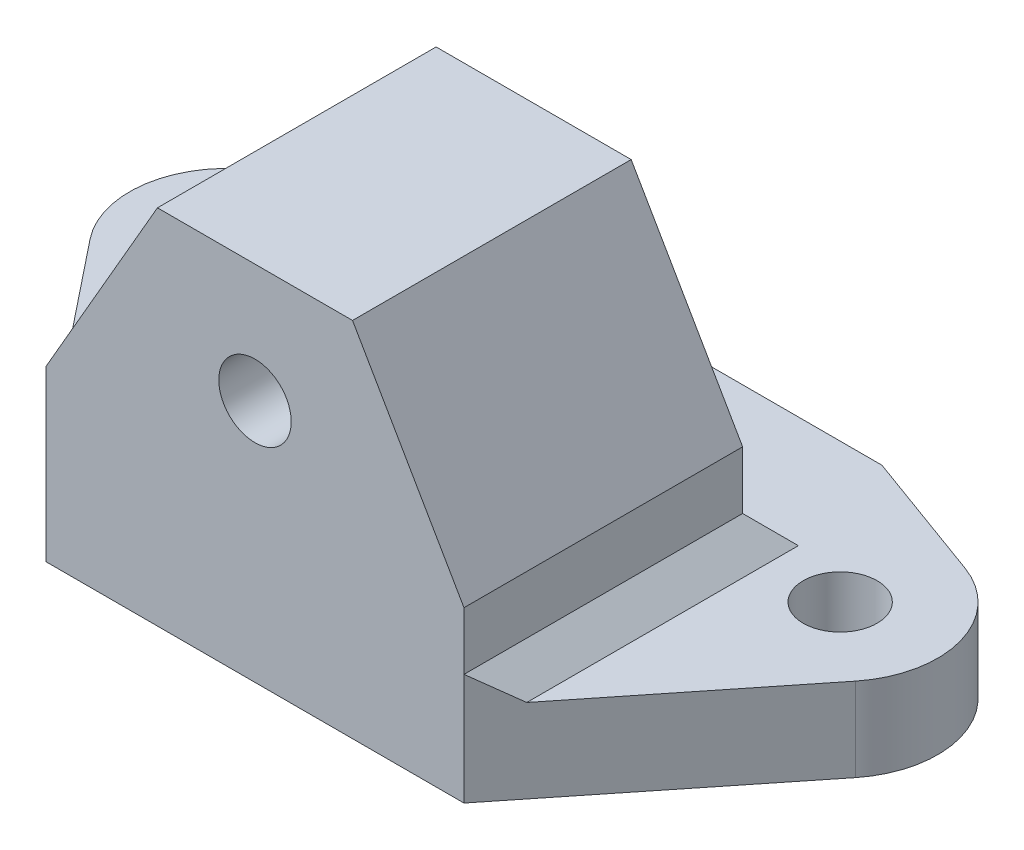
from build123d import *

# Parameters (mm, degrees)
SKETCH1_W           = 30
SKETCH1_H           = 26
BOSS_EXTRUDE1_DEPTH = 30
SKETCH2_R           = 5.25
CUT_EXTRUDE1_DEPTH  = 15
CUT_EXTRUDE2_REACH  = 37.972
SKETCH3_R           = 2.6
SKETCH4_R           = 2.65
BOSS_EXTRUDE2_DEPTH = 6
CHAMFER1_SIZE       = 8
CHAMFER1_SIZE2      = 13.856406461
SKETCH5_W           = 10
SKETCH5_H           = 20
CUT_EXTRUDE3_DEPTH  = 20
CHAMFER2_SIZE       = 2


with BuildPart() as part:
    # Sketch1 → Boss-Extrude1 (new body)
    with BuildSketch(Plane.XY):
        Rectangle(SKETCH1_W, SKETCH1_H)
    extrude(amount=BOSS_EXTRUDE1_DEPTH)

    # Sketch2 → Cut-Extrude1 (cut)
    with BuildSketch(Plane.XY):
        with Locations((0, 4.5)):
            Circle(SKETCH2_R)
    extrude(amount=CUT_EXTRUDE1_DEPTH, mode=Mode.SUBTRACT)

    # Sketch3 → Cut-Extrude2 (cut, up to next)
    with BuildSketch(Plane.XY, mode=Mode.PRIVATE) as cut_extrude2_sk1:
        with Locations((0, 4.5)):
            Circle(SKETCH3_R)
    cut_extrude2_tool1 = extrude(cut_extrude2_sk1.sketch, amount=CUT_EXTRUDE2_REACH, mode=Mode.PRIVATE) & part.part
    add(cut_extrude2_tool1.solids().sort_by_distance((0, 4.5, 0))[0], mode=Mode.SUBTRACT)

    # Sketch4 → Boss-Extrude2 (add)
    # profile 1 of 2: a face of its own
    with BuildSketch(Plane.XZ.offset(13)):
        with BuildLine():
            Line((-15, 30), (-27.472160356, 14.365256125))
            ThreePointArc((-27.472160356, 14.365256125), (-28.738776961, 8.10556471), (-24.395973154, 3.422818792))
            Line((-24.395973154, 3.422818792), (-15, 0))
            Line((-15, 0), (-15, 30))
        make_face()
        with Locations(Location((-22, 10, 0), (0, 0, 270))):
            Circle(SKETCH4_R, mode=Mode.SUBTRACT)
    # profile 2 of 2: a face of its own
    with BuildSketch(Plane.XZ.offset(13)):
        with BuildLine():
            Line((15, 0), (24.395973154, 3.422818792))
            ThreePointArc((24.395973154, 3.422818792), (28.738776961, 8.10556471), (27.472160356, 14.365256125))
            Line((27.472160356, 14.365256125), (15, 30))
            Line((15, 30), (15, 0))
        make_face()
        with Locations(Location((22, 10, 0), (0, 0, 90))):
            Circle(SKETCH4_R, mode=Mode.SUBTRACT)
    extrude(amount=-BOSS_EXTRUDE2_DEPTH)

    # Chamfer1
    chamfer1_edges = [part.edges().sort_by_distance(p)[0] for p in [
        (-15, 13, 15),
        (15, 13, 15),
    ]]
    chamfer1_side = [part.faces().sort_by_distance(p)[0] for p in [
        (0, 13, 15),
    ]]
    chamfer(chamfer1_edges, length=CHAMFER1_SIZE, length2=CHAMFER1_SIZE2, reference=chamfer1_side[0])

    # Sketch5 → Cut-Extrude3 (cut, symmetric)
    with BuildSketch(Plane(origin=(0, 0, 0), x_dir=(0, 0, -1), z_dir=(1, 0, 0))):
        with Locations((-5, 3)):
            Rectangle(SKETCH5_W, SKETCH5_H)
    extrude(amount=CUT_EXTRUDE3_DEPTH, both=True, mode=Mode.SUBTRACT)

    # Chamfer2
    chamfer2_edges = [part.edges().sort_by_distance(p)[0] for p in [
        (-15, -7, 20),
        (15, -7, 20),
        (0, -7, 10),
    ]]
    chamfer(chamfer2_edges, length=CHAMFER2_SIZE)


solid = part.part
